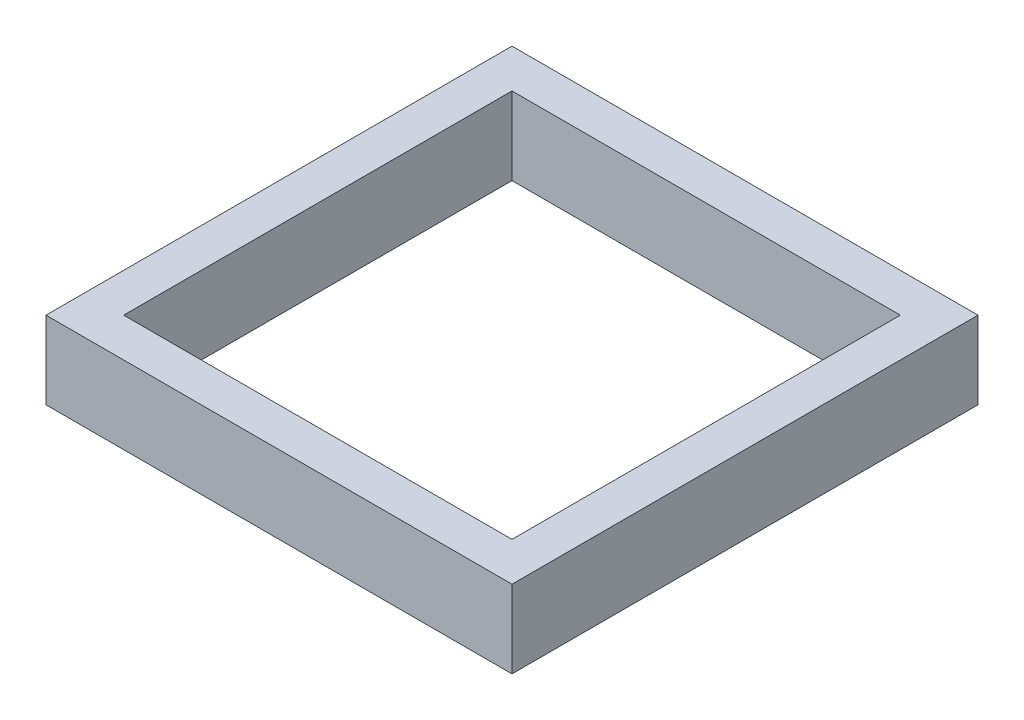
from build123d import *

# Parameters (mm, degrees)
SKETCH1_W           = 60
SKETCH1_H           = 60
BOSS_EXTRUDE1_DEPTH = 10
SKETCH2_W           = 50
SKETCH2_H           = 50
CUT_EXTRUDE1_DEPTH  = 10


with BuildPart() as part:
    # Sketch1 → Boss-Extrude1 (new body)
    with BuildSketch(Plane(origin=(0, 0, 0), x_dir=(1, 0, 0), z_dir=(0, 1, 0))):
        Rectangle(SKETCH1_W, SKETCH1_H)
    extrude(amount=BOSS_EXTRUDE1_DEPTH)

    # Sketch2 → Cut-Extrude1 (cut)
    with BuildSketch(Plane(origin=(0, 10, 0), x_dir=(1, 0, 0), z_dir=(0, 1, 0))):
        Rectangle(SKETCH2_W, SKETCH2_H)
    extrude(amount=-CUT_EXTRUDE1_DEPTH, mode=Mode.SUBTRACT)


solid = part.part
